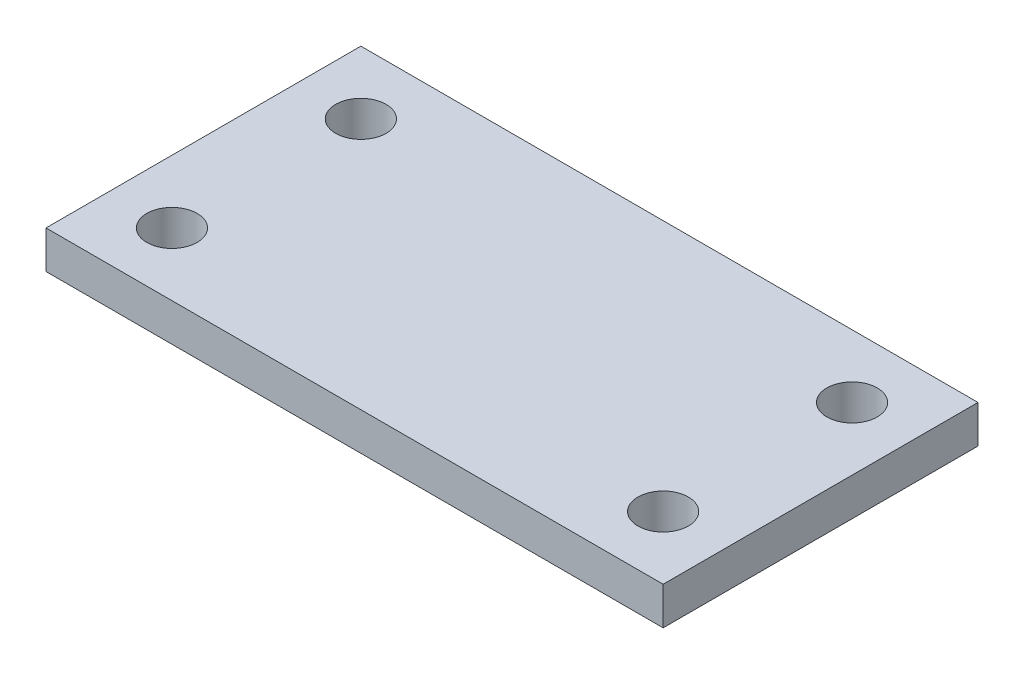
from build123d import *

# Parameters (mm, degrees)
SKETCH2_W           = 49
SKETCH2_H           = 25
BOSS_EXTRUDE1_DEPTH = 3
SKETCH3_R           = 2
CUT_EXTRUDE1_DEPTH  = 3


with BuildPart() as part:
    # Sketch2 → Boss-Extrude1 (new body)
    with BuildSketch(Plane(origin=(0, 0, 0), x_dir=(1, 0, 0), z_dir=(0, 1, 0))):
        with Locations((-7.199052133, 1.433649289)):
            Rectangle(SKETCH2_W, SKETCH2_H)
    extrude(amount=BOSS_EXTRUDE1_DEPTH)

    # Sketch3 → Cut-Extrude1 (cut)
    with BuildSketch(Plane(origin=(0, 3, 0), x_dir=(1, 0, 0), z_dir=(0, 1, 0))):
        with Locations(Location((-26.699052133, 8.933649289, 0), (0, 0, 270))):
            Circle(SKETCH3_R)
        with Locations(Location((-26.699052133, -6.066350711, 0), (0, 0, 270))):
            Circle(SKETCH3_R)
        with Locations(Location((12.300947867, 8.933649289, 0), (0, 0, 270))):
            Circle(SKETCH3_R)
        with Locations(Location((12.300947867, -6.066350711, 0), (0, 0, 270))):
            Circle(SKETCH3_R)
    extrude(amount=-CUT_EXTRUDE1_DEPTH, mode=Mode.SUBTRACT)


solid = part.part
